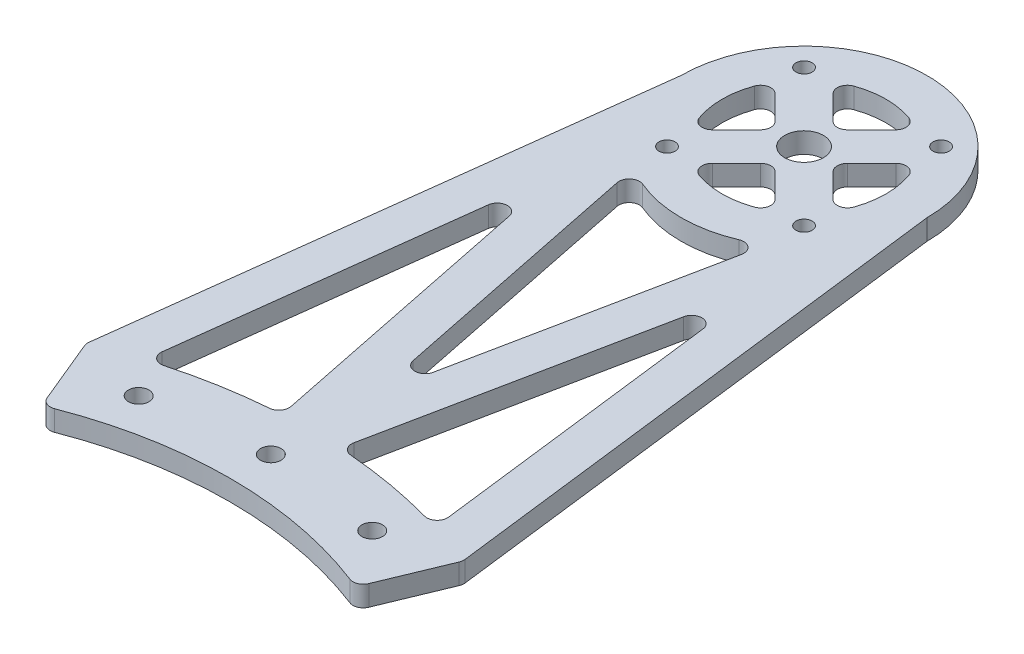
from build123d import *

# Parameters (mm, degrees)
SKETCH1_R           = 1.25
SKETCH1_R_2         = 1.5875
SKETCH1_R_3         = 1.587499999
SKETCH1_R_4         = 3
BOSS_EXTRUDE1_DEPTH = 3.175


with BuildPart() as part:
    # Sketch1 → Boss-Extrude1 (new body)
    with BuildSketch(Plane(origin=(0, 0, 0), x_dir=(1, 0, 0), z_dir=(0, 1, 0))):
        with BuildLine():
            Line((-19.061691445, 152.305177286), (-29.109279467, 70.814859111))
            ThreePointArc((-29.109279467, 70.814859111), (-29.106764186, 70.406916612), (-29.000369251, 70.01308476))
            Line((-29.000369251, 70.01308476), (-24.900498144, 60.115120329))
            ThreePointArc((-24.900498144, 60.115120329), (-24.059191565, 59.263489811), (-22.862282328, 59.241590515))
            ThreePointArc((-22.862282328, 59.241590515), (0, 63.5), (22.862282328, 59.241590515))
            ThreePointArc((22.862282328, 59.241590515), (24.059191565, 59.263489811), (24.900498144, 60.115120329))
            Line((24.900498144, 60.115120329), (29.000369251, 70.01308476))
            ThreePointArc((29.000369251, 70.01308476), (29.106764186, 70.406916612), (29.109279467, 70.814859111))
            Line((29.109279467, 70.814859111), (19.061691445, 152.305177286))
            ThreePointArc((19.061691445, 152.305177286), (19.052985039, 152.398309253), (19.049778848, 152.491792328))
            ThreePointArc((19.049778848, 152.491792328), (0, 171.45), (-19.049778848, 152.491792328))
            ThreePointArc((-19.049778848, 152.491792328), (-19.052985039, 152.398309253), (-19.061691445, 152.305177286))
        make_face()
        with Locations(Location((-10.606601718, 163.006601718, 0), (0, 0, 270))):
            Circle(SKETCH1_R, mode=Mode.SUBTRACT)
        with Locations(Location((0, 69.85, 0), (0, 0, 270))):
            Circle(SKETCH1_R_2, mode=Mode.SUBTRACT)
        with Locations(Location((18.0785103, 67.469918962, 0), (0, 0, 270))):
            Circle(SKETCH1_R_2, mode=Mode.SUBTRACT)
        with Locations(Location((10.606601718, 163.006601718, 0), (0, 0, 270))):
            Circle(SKETCH1_R, mode=Mode.SUBTRACT)
        with Locations(Location((10.606601718, 141.793398282, 0), (0, 0, 270))):
            Circle(SKETCH1_R, mode=Mode.SUBTRACT)
        with Locations(Location((-10.606601718, 141.793398282, 0), (0, 0, 270))):
            Circle(SKETCH1_R, mode=Mode.SUBTRACT)
        with Locations(Location((-18.078510302, 67.469918971, 0), (0, 0, 270))):
            Circle(SKETCH1_R_3, mode=Mode.SUBTRACT)
        with Locations(Location((0, 152.4, 0), (0, 0, 270))):
            Circle(SKETCH1_R_4, mode=Mode.SUBTRACT)
        with BuildLine():
            Line((-13.497810395, 120.266290898), (-4.865408959, 77.838541906))
            ThreePointArc((-4.865408959, 77.838541906), (-5.15124286, 76.569257194), (-6.289995152, 75.939949704))
            ThreePointArc((-6.289995152, 75.939949704), (-13.288948331, 75.032285399), (-20.173905346, 73.480974021))
            ThreePointArc((-20.173905346, 73.480974021), (-21.632306598, 73.810794489), (-22.169764015, 75.206092049))
            Line((-22.169764015, 75.206092049), (-16.629007128, 120.144045384))
            ThreePointArc((-16.629007128, 120.144045384), (-15.115368796, 121.53607252), (-13.497810395, 120.266290898))
        make_face(mode=Mode.SUBTRACT)
        with BuildLine():
            Line((-9.626782179, 133.089731304), (-1.555627758, 93.42047862))
            ThreePointArc((-1.555627758, 93.42047862), (0, 92.149488537), (1.555627758, 93.42047862))
            Line((1.555627758, 93.42047862), (9.626782179, 133.089731304))
            ThreePointArc((9.626782179, 133.089731304), (9.075338598, 134.635781943), (7.450296388, 134.867299588))
            ThreePointArc((7.450296388, 134.867299588), (0, 133.35), (-7.450296388, 134.867299588))
            ThreePointArc((-7.450296388, 134.867299588), (-9.075338598, 134.635781943), (-9.626782179, 133.089731304))
        make_face(mode=Mode.SUBTRACT)
        with BuildLine():
            Line((4.854451798, 161.744579859), (1.122532015, 158.012660076))
            ThreePointArc((1.122532015, 158.012660076), (0, 157.547692091), (-1.122532015, 158.012660076))
            Line((-1.122532015, 158.012660076), (-4.854451798, 161.744579859))
            ThreePointArc((-4.854451798, 161.744579859), (-5.280651093, 163.215805982), (-4.265051181, 164.36241357))
            ThreePointArc((-4.265051181, 164.36241357), (0, 165.1), (4.265051181, 164.36241357))
            ThreePointArc((4.265051181, 164.36241357), (5.280651093, 163.215805982), (4.854451798, 161.744579859))
        make_face(mode=Mode.SUBTRACT)
        with BuildLine():
            Line((-1.122532015, 146.787339924), (-4.854451798, 143.055420141))
            ThreePointArc((-4.854451798, 143.055420141), (-5.280651093, 141.584194018), (-4.265051181, 140.43758643))
            ThreePointArc((-4.265051181, 140.43758643), (0, 139.7), (4.265051181, 140.43758643))
            ThreePointArc((4.265051181, 140.43758643), (5.280651093, 141.584194018), (4.854451798, 143.055420141))
            Line((4.854451798, 143.055420141), (1.122532015, 146.787339924))
            ThreePointArc((1.122532015, 146.787339924), (0, 147.252307909), (-1.122532015, 146.787339924))
        make_face(mode=Mode.SUBTRACT)
        with BuildLine():
            Line((9.344579859, 157.254451798), (5.612660076, 153.522532015))
            ThreePointArc((5.612660076, 153.522532015), (5.147692091, 152.4), (5.612660076, 151.277467985))
            Line((5.612660076, 151.277467985), (9.344579859, 147.545548202))
            ThreePointArc((9.344579859, 147.545548202), (10.815805982, 147.119348907), (11.96241357, 148.134948819))
            ThreePointArc((11.96241357, 148.134948819), (12.7, 152.4), (11.96241357, 156.665051181))
            ThreePointArc((11.96241357, 156.665051181), (10.815805982, 157.680651093), (9.344579859, 157.254451798))
        make_face(mode=Mode.SUBTRACT)
        with BuildLine():
            Line((4.865408959, 77.838541906), (13.497810395, 120.266290898))
            ThreePointArc((13.497810395, 120.266290898), (15.115368796, 121.53607252), (16.629007128, 120.144045384))
            Line((16.629007128, 120.144045384), (22.169764015, 75.206092049))
            ThreePointArc((22.169764015, 75.206092049), (21.632306598, 73.810794489), (20.173905346, 73.480974021))
            ThreePointArc((20.173905346, 73.480974021), (13.288948331, 75.032285399), (6.289995152, 75.939949704))
            ThreePointArc((6.289995152, 75.939949704), (5.15124286, 76.569257194), (4.865408959, 77.838541906))
        make_face(mode=Mode.SUBTRACT)
        with BuildLine():
            Line((-5.612660076, 153.522532015), (-9.344579859, 157.254451798))
            ThreePointArc((-9.344579859, 157.254451798), (-10.815805982, 157.680651093), (-11.96241357, 156.665051181))
            ThreePointArc((-11.96241357, 156.665051181), (-12.7, 152.4), (-11.96241357, 148.134948819))
            ThreePointArc((-11.96241357, 148.134948819), (-10.815805982, 147.119348907), (-9.344579859, 147.545548202))
            Line((-9.344579859, 147.545548202), (-5.612660076, 151.277467985))
            ThreePointArc((-5.612660076, 151.277467985), (-5.147692091, 152.4), (-5.612660076, 153.522532015))
        make_face(mode=Mode.SUBTRACT)
    extrude(amount=BOSS_EXTRUDE1_DEPTH)


solid = part.part
